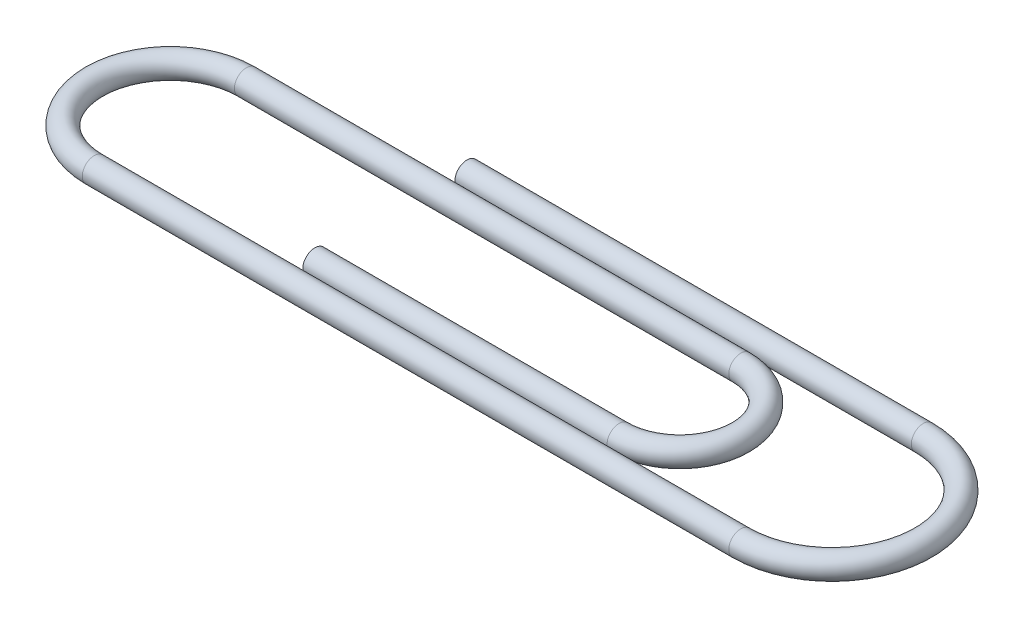
from build123d import *

# Parameters (mm, degrees)
SKETCH2_R = 7.8861463


with BuildPart() as part:
    # Sweep1: sweep along a path in Sketch1
    with BuildLine(Plane(origin=(0, 0, 0), x_dir=(1, 0, 0), z_dir=(0, 1, 0))) as sweep1_path:
        Line((0, 0), (200, 0))
        ThreePointArc((200, 0), (240, 40), (200, 80))
        Line((200, 80), (-125, 80))
        ThreePointArc((-125, 80), (-175, 30), (-125, -20))
        Line((-125, -20), (300, -20))
        ThreePointArc((300, -20), (360, 40), (300, 100))
        Line((300, 100), (0, 100))
    # Sketch2 → Sweep1 (sweep)
    with BuildSketch(Plane(origin=(0, 0, 0), x_dir=(0, 0, -1), z_dir=(1, 0, 0))):
        Circle(SKETCH2_R)
    sweep(path=sweep1_path.line)


solid = part.part
